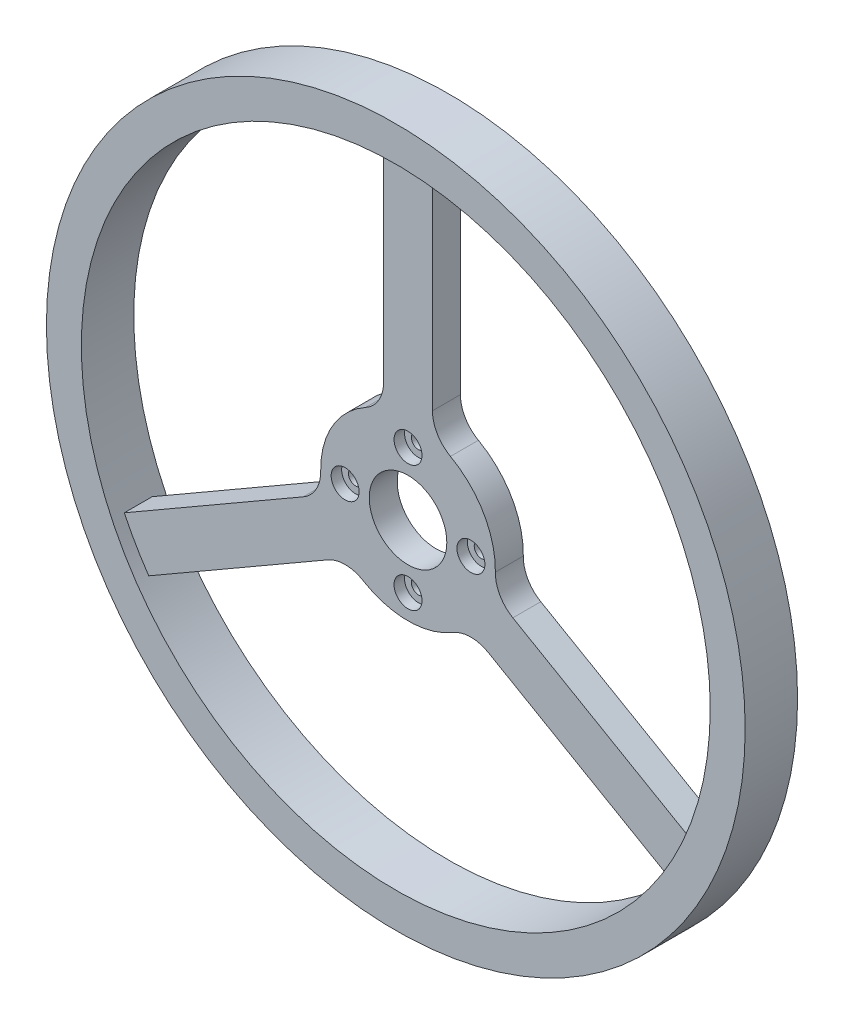
from build123d import *

# Parameters (mm, degrees)
SKETCH1_R               = 100
BOSS_EXTRUDE1_DEPTH     = 15
CUT_EXTRUDE1_DEPTH      = 143.214626533
CUT_EXTRUDE1_DEPTH_BACK = 143.214626533
SKETCH2_R               = 90
BOSS_EXTRUDE3_START     = 3.5
SKETCH5_R               = 25
BOSS_EXTRUDE3_DEPTH     = 8
BOSS_EXTRUDE4_START     = 3.5
SKETCH6_W               = 14
SKETCH6_H               = 70
BOSS_EXTRUDE4_DEPTH     = 8
SKETCH9_R               = 11.1
CUT_EXTRUDE4_DEPTH      = 143.214626533
SKETCH10_R              = 2.05
CUT_EXTRUDE5_DEPTH      = 143.214626533
FILLET3_R               = 10
CUT_EXTRUDE6_START      = 8.5
SKETCH11_R              = 4
CUT_EXTRUDE6_DEPTH      = 3


with BuildPart() as part:
    # Sketch1 → Boss-Extrude1 (new body)
    with BuildSketch(Plane.XY):
        Circle(SKETCH1_R)
    extrude(amount=BOSS_EXTRUDE1_DEPTH)

    # Sketch2 → Cut-Extrude1 (cut, two sides: drawn at the far end of the back side and taken through both)
    with BuildSketch(Plane.XY.offset(-CUT_EXTRUDE1_DEPTH_BACK)):
        Circle(SKETCH2_R)
    extrude(amount=CUT_EXTRUDE1_DEPTH + CUT_EXTRUDE1_DEPTH_BACK, mode=Mode.SUBTRACT)



with BuildPart() as body_2:
    # Sketch5 → Boss-Extrude3 (new body)
    with BuildSketch(Plane.XY.offset(BOSS_EXTRUDE3_START)):
        Circle(SKETCH5_R)
    extrude(amount=BOSS_EXTRUDE3_DEPTH)


with BuildPart() as part_1:
    add(part.part)

    add(body_2.part)  # Boss-Extrude4 merges body 2
    # Sketch6 → Boss-Extrude4 (add)
    with BuildSketch(Plane.XY.offset(BOSS_EXTRUDE4_START)):
        with Locations((0, 59)):
            Rectangle(SKETCH6_W, SKETCH6_H)
        Polygon((17.284609691, -18.062177826), (77.906387956, -53.062177826), (84.906387956, -40.937822174), (24.284609691, -5.937822174), align=None)
        Polygon((-17.284609691, -18.062177826), (-77.906387956, -53.062177826), (-84.906387956, -40.937822174), (-24.284609691, -5.937822174), align=None)
    extrude(amount=BOSS_EXTRUDE4_DEPTH)

    # Sketch9 → Cut-Extrude4 (cut, through all)
    with BuildSketch(Plane.XY):
        Circle(SKETCH9_R)
    extrude(amount=CUT_EXTRUDE4_DEPTH, mode=Mode.SUBTRACT)

    # Sketch10 → Cut-Extrude5 (cut, through all)
    with BuildSketch(Plane.XY):
        with Locations((0, 18)):
            Circle(SKETCH10_R)
        with Locations((18, 0)):
            Circle(SKETCH10_R)
        with Locations((0, -18)):
            Circle(SKETCH10_R)
        with Locations((-18, 0)):
            Circle(SKETCH10_R)
    extrude(amount=CUT_EXTRUDE5_DEPTH, mode=Mode.SUBTRACT)

    # Fillet3
    fillet3_edges = [part_1.edges().sort_by_distance(p)[0] for p in [
        (-7, 24, 7.5),
        (7, 24, 7.5),
        (24.284609691, -5.937822174, 7.5),
        (17.284609691, -18.062177826, 7.5),
        (-17.284609691, -18.062177826, 7.5),
        (-24.284609691, -5.937822174, 7.5),
    ]]
    fillet(fillet3_edges, radius=FILLET3_R)

    # Sketch11 → Cut-Extrude6 (cut)
    with BuildSketch(Plane.XY.offset(CUT_EXTRUDE6_START)):
        with Locations((18, 0)):
            Circle(SKETCH11_R)
        with Locations((0, -18)):
            Circle(SKETCH11_R)
        with Locations((-18, 0)):
            Circle(SKETCH11_R)
        with Locations((0, 18)):
            Circle(SKETCH11_R)
    extrude(amount=CUT_EXTRUDE6_DEPTH, mode=Mode.SUBTRACT)


solid = part_1.part
